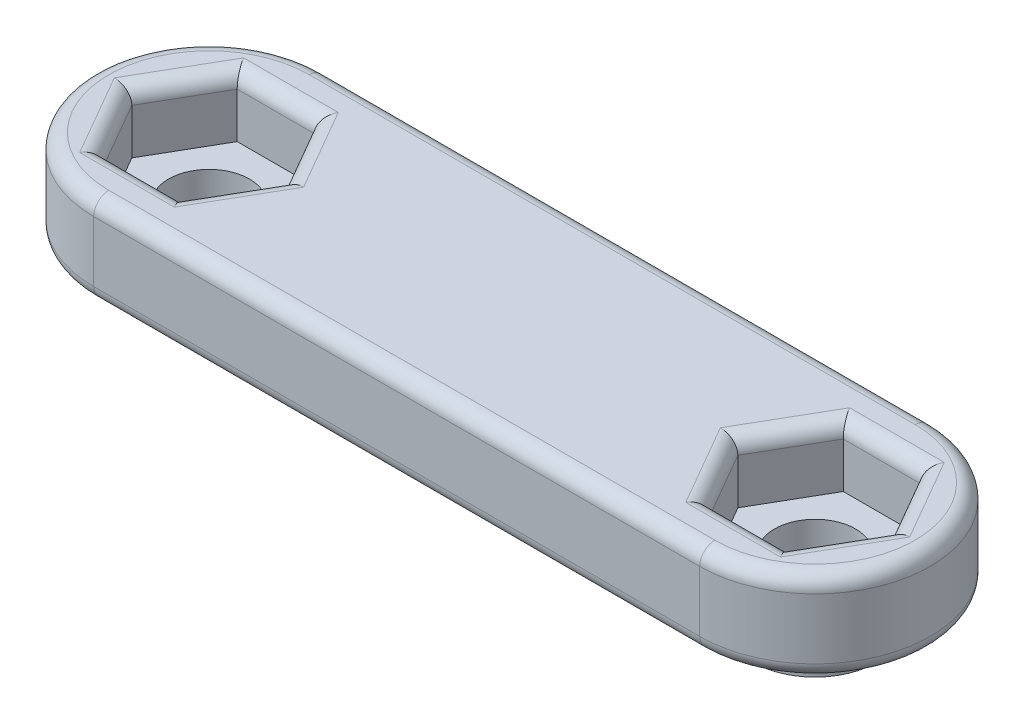
from build123d import *

# Parameters (mm, degrees)
BOSS_EXTRUDE1_DEPTH = 4.5
BOSS_EXTRUDE2_DEPTH = 1.5
CUT_EXTRUDE1_DEPTH  = 1.2375
SKETCH6_R           = 2.125
BOSS_EXTRUDE3_DEPTH = 1.5875
BOSS_EXTRUDE4_START = 1.778
SKETCH7_R           = 3.25
SKETCH7_R_2         = 2.125
BOSS_EXTRUDE4_DEPTH = 1.778
FILLET2_R           = 0.79375
FILLET3_R           = 0.79375


with BuildPart() as part:
    # Sketch1 → Boss-Extrude1 (new body)
    with BuildSketch(Plane(origin=(0, 0, 0), x_dir=(1, 0, 0), z_dir=(0, 1, 0))):
        with BuildLine():
            Line((-15.875, 6.04), (15.875, 6.04))
            ThreePointArc((15.875, 6.04), (21.915, 0), (15.875, -6.04))
            Line((15.875, -6.04), (-15.875, -6.04))
            ThreePointArc((-15.875, -6.04), (-21.915, 0), (-15.875, 6.04))
        make_face()
        Polygon((-13.854274058, 3.5), (-17.895725942, 3.5), (-19.916451884, 0), (-17.895725942, -3.5), (-13.854274058, -3.5), (-11.833548116, 0), align=None, mode=Mode.SUBTRACT)
        Polygon((17.895725942, 3.5), (13.854274058, 3.5), (11.833548116, 0), (13.854274058, -3.5), (17.895725942, -3.5), (19.916451884, 0), align=None, mode=Mode.SUBTRACT)
    extrude(amount=BOSS_EXTRUDE1_DEPTH)

    # Sketch2 → Boss-Extrude2 (add)
    with BuildSketch(Plane(origin=(0, 4.5, 0), x_dir=(1, 0, 0), z_dir=(0, 1, 0))):
        with BuildLine():
            Line((15.875, 6.04), (-15.875, 6.04))
            ThreePointArc((-15.875, 6.04), (-21.915, 0), (-15.875, -6.04))
            Line((-15.875, -6.04), (15.875, -6.04))
            ThreePointArc((15.875, -6.04), (21.915, 0), (15.875, 6.04))
        make_face()
        Polygon((19.916451884, 0), (17.895725942, 3.5), (13.854274058, 3.5), (11.833548116, 0), (13.854274058, -3.5), (17.895725942, -3.5), align=None, mode=Mode.SUBTRACT)
        Polygon((-17.895725942, 3.5), (-19.916451884, 0), (-17.895725942, -3.5), (-13.854274058, -3.5), (-11.833548116, 0), (-13.854274058, 3.5), align=None, mode=Mode.SUBTRACT)
    extrude(amount=BOSS_EXTRUDE2_DEPTH)

    # Sketch3 → Cut-Extrude1 (cut)
    with BuildSketch(Plane.XZ):
        with BuildLine():
            Line((15.875, 6.04), (-15.875, 6.04))
            ThreePointArc((-15.875, 6.04), (-21.915, 0), (-15.875, -6.04))
            Line((-15.875, -6.04), (15.875, -6.04))
            ThreePointArc((15.875, -6.04), (21.915, 0), (15.875, 6.04))
        make_face()
    extrude(amount=-CUT_EXTRUDE1_DEPTH, mode=Mode.SUBTRACT)

    # Sketch6 → Boss-Extrude3 (add)
    with BuildSketch(Plane.XZ.offset(-1.2375)):
        Polygon((13.854274058, 3.5), (11.833548116, 0), (13.854274058, -3.5), (17.895725942, -3.5), (19.916451884, 0), (17.895725942, 3.5), align=None)
        with Locations(Location((15.875, 0, 0), (0, 0, 270))):
            Circle(SKETCH6_R, mode=Mode.SUBTRACT)
    boss_extrude3 = extrude(amount=-BOSS_EXTRUDE3_DEPTH)

    # Sketch7 → Boss-Extrude4 (add)
    with BuildSketch(Plane.XZ.offset(-1.2375).offset(BOSS_EXTRUDE4_START)):
        with Locations(Location((15.875, 0, 0), (0, 0, 270))):
            Circle(SKETCH7_R)
        with Locations(Location((15.875, 0, 0), (0, 0, 270))):
            Circle(SKETCH7_R_2, mode=Mode.SUBTRACT)
    boss_extrude4 = extrude(amount=-BOSS_EXTRUDE4_DEPTH)

    # Mirror1: Boss-Extrude3, Boss-Extrude4 across plane
    add(boss_extrude3.mirror(Plane(origin=(0, 0, 0), x_dir=(0, 0, 1), z_dir=(1, 0, 0))))
    add(boss_extrude4.mirror(Plane(origin=(0, 0, 0), x_dir=(0, 0, 1), z_dir=(1, 0, 0))))

    # Fillet2
    fillet2_edges = [part.edges().sort_by_distance(p)[0] for p in [
        (21.915, 1.2375, 0),
        (0, 1.2375, -6.04),
        (-21.915, 1.2375, 0),
        (0, 1.2375, 6.04),
        (15.875, 1.2375, 3.25),
        (-15.875, 1.2375, 3.25),
    ]]
    fillet(fillet2_edges, radius=FILLET2_R)

    # Fillet3
    fillet3_edges = [part.edges().sort_by_distance(p)[0] for p in [
        (21.915, 6, 0),
        (0, 6, -6.04),
        (-21.915, 6, 0),
        (0, 6, 6.04),
        (18.906088913, 6, 1.75),
        (15.875, 6, 3.5),
        (12.843911087, 6, 1.75),
        (12.843911087, 6, -1.75),
        (15.875, 6, -3.5),
        (18.906088913, 6, -1.75),
        (-15.875, 6, -3.5),
        (-12.843911087, 6, -1.75),
        (-12.843911087, 6, 1.75),
        (-15.875, 6, 3.5),
        (-18.906088913, 6, 1.75),
        (-18.906088913, 6, -1.75),
    ]]
    fillet(fillet3_edges, radius=FILLET3_R)


solid = part.part
